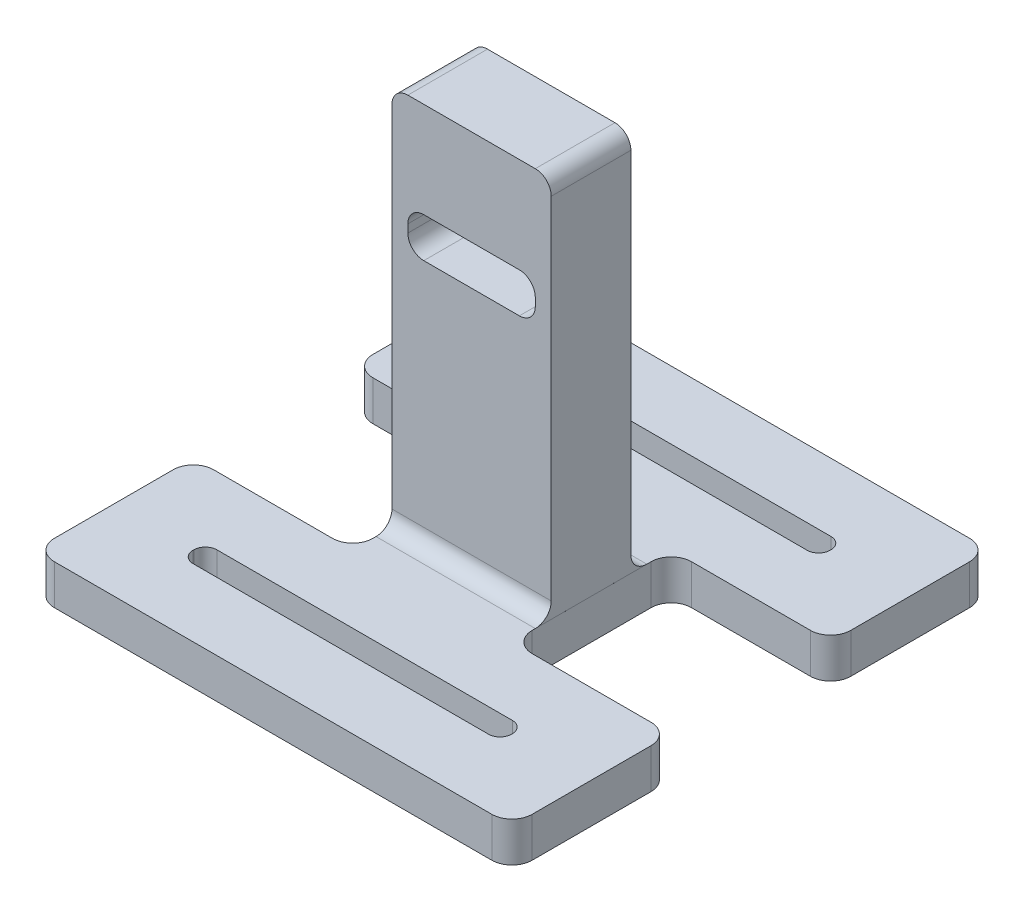
from build123d import *

# Parameters (mm, degrees)
BOSS_EXTRUDE1_DEPTH = 5
CUT_EXTRUDE1_DEPTH  = 43.772012023
FILLET1_R           = 2.54
SKETCH3_W           = 20
SKETCH3_H           = 10
BOSS_EXTRUDE2_DEPTH = 48
SKETCH4_W           = 16
SKETCH4_H           = 5
CUT_EXTRUDE4_DEPTH  = 32
FILLET2_R           = 2


with BuildPart() as part:
    # Sketch1 → Boss-Extrude1 (new body)
    with BuildSketch(Plane(origin=(0, 0, 0), x_dir=(1, 0, 0), z_dir=(0, 1, 0))):
        Polygon((-29.999623956, -29.926382831), (30.000376044, -29.926382831), (30.000376044, -9.926382831), (10.000376044, -9.926382831), (10.000376044, 10.073617169), (30.000376044, 10.073617169), (30.000376044, 30.073617169), (-29.999623956, 30.073617169), (-29.999623956, 10.073617169), (-9.999623956, 10.073617169), (-9.999623956, -9.926382831), (-29.999623956, -9.926382831), align=None)
    extrude(amount=BOSS_EXTRUDE1_DEPTH)

    # Sketch2 → Cut-Extrude1 (cut, through all)
    with BuildSketch(Plane(origin=(0, 5, 0), x_dir=(1, 0, 0), z_dir=(0, 1, 0))):
        with BuildLine():
            Line((-18.549247911, 18.573617169), (18.55, 18.573617169))
            ThreePointArc((18.55, 18.573617169), (19.575304833, 18.998312337), (20, 20.023617169))
            Line((20, 20.023617169), (20, 20.123617169))
            ThreePointArc((20, 20.123617169), (19.575304833, 21.148922002), (18.55, 21.573617169))
            Line((18.55, 21.573617169), (-18.549247911, 21.573617169))
            ThreePointArc((-18.549247911, 21.573617169), (-19.574552744, 21.148922002), (-19.999247911, 20.123617169))
            Line((-19.999247911, 20.123617169), (-19.999247911, 20.023617169))
            ThreePointArc((-19.999247911, 20.023617169), (-19.574552744, 18.998312337), (-18.549247911, 18.573617169))
        make_face()
        with BuildLine():
            Line((-18.549623956, -21.426382831), (18.550376044, -21.426382831))
            ThreePointArc((18.550376044, -21.426382831), (19.575680877, -21.001687663), (20.000376044, -19.976382831))
            Line((20.000376044, -19.976382831), (20.000376044, -19.876382831))
            ThreePointArc((20.000376044, -19.876382831), (19.575680877, -18.851077998), (18.550376044, -18.426382831))
            Line((18.550376044, -18.426382831), (-18.549623956, -18.426382831))
            ThreePointArc((-18.549623956, -18.426382831), (-19.574928788, -18.851077998), (-19.999623956, -19.876382831))
            Line((-19.999623956, -19.876382831), (-19.999623956, -19.976382831))
            ThreePointArc((-19.999623956, -19.976382831), (-19.574928788, -21.001687663), (-18.549623956, -21.426382831))
        make_face()
    extrude(amount=-CUT_EXTRUDE1_DEPTH, mode=Mode.SUBTRACT)

    # Fillet1
    fillet1_edges = [part.edges().sort_by_distance(p)[0] for p in [
        (-29.999623956, 2.5, -10.073617169),
        (-29.999623956, 2.5, -30.073617169),
        (30.000376044, 2.5, -30.073617169),
        (30.000376044, 2.5, -10.073617169),
        (10.000376044, 2.5, -10.073617169),
        (10.000376044, 2.5, 9.926382831),
        (30.000376044, 2.5, 9.926382831),
        (30.000376044, 2.5, 29.926382831),
        (-29.999623956, 2.5, 29.926382831),
        (-29.999623956, 2.5, 9.926382831),
        (-9.999623956, 2.5, 9.926382831),
        (-9.999623956, 2.5, -10.073617169),
    ]]
    fillet(fillet1_edges, radius=FILLET1_R)

    # Sketch3 → Boss-Extrude2 (add)
    with BuildSketch(Plane(origin=(0, 5, 0), x_dir=(1, 0, 0), z_dir=(0, 1, 0))):
        Rectangle(SKETCH3_W, SKETCH3_H)
    extrude(amount=BOSS_EXTRUDE2_DEPTH)

    # Sketch4 → Cut-Extrude4 (cut)
    with BuildSketch(Plane(origin=(0, 0, -5), x_dir=(-1, 0, 0), z_dir=(0, 0, -1))):
        with Locations((0, 38.5)):
            Rectangle(SKETCH4_W, SKETCH4_H)
    extrude(amount=-CUT_EXTRUDE4_DEPTH, mode=Mode.SUBTRACT)

    # Fillet2
    fillet2_edges = [part.edges().sort_by_distance(p)[0] for p in [
        (0.000188022, 5, 5),
        (0.000188022, 5, -5),
        (10, 53, 0),
        (-10, 53, 0),
        (-8, 41, 0),
        (-8, 36, 0),
        (8, 36, 0),
        (8, 41, 0),
    ]]
    fillet(fillet2_edges, radius=FILLET2_R)


solid = part.part
